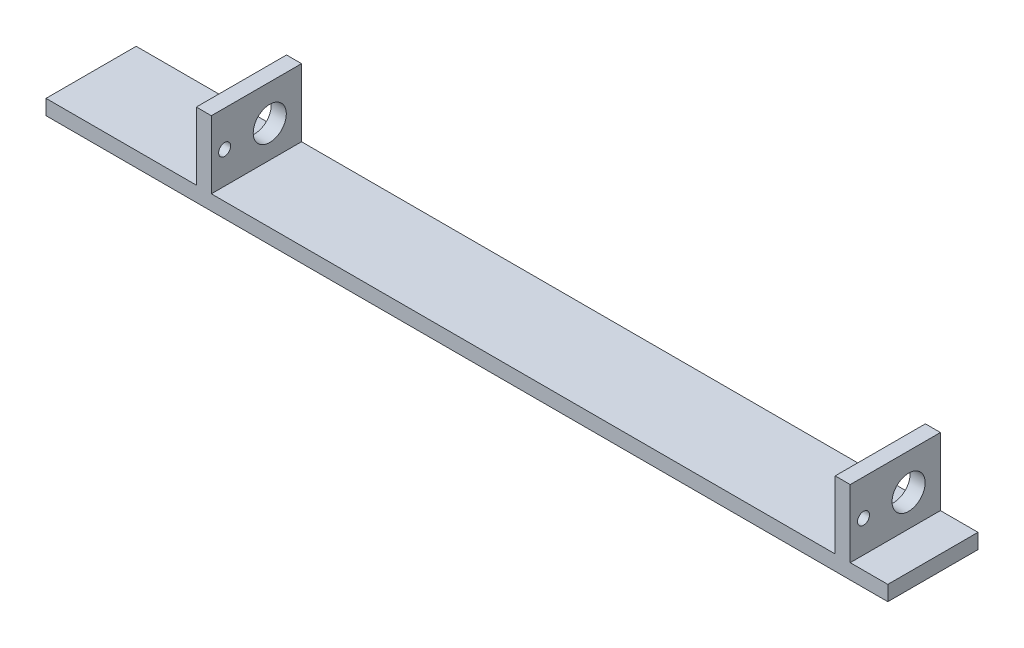
from build123d import *

# Parameters (mm, degrees)
SKETCH1_W           = 560
SKETCH1_H           = 60
BOSS_EXTRUDE1_DEPTH = 10
SKETCH2_W           = 10
SKETCH2_H           = 60
BOSS_EXTRUDE2_DEPTH = 45
SKETCH3_R           = 11
SKETCH3_R_2         = 4
CUT_EXTRUDE1_DEPTH  = 440
SKETCH4_R           = 5
BOSS_EXTRUDE3_DEPTH = 10


with BuildPart() as part:
    # Sketch1 → Boss-Extrude1 (new body)
    with BuildSketch(Plane(origin=(0, 0, 0), x_dir=(1, 0, 0), z_dir=(0, 1, 0))):
        Rectangle(SKETCH1_W, SKETCH1_H)
    extrude(amount=BOSS_EXTRUDE1_DEPTH)

    # Sketch2 → Boss-Extrude2 (add)
    with BuildSketch(Plane(origin=(0, 10, 0), x_dir=(1, 0, 0), z_dir=(0, 1, 0))):
        with Locations((-175, 0)):
            Rectangle(SKETCH2_W, SKETCH2_H)
        with Locations((250, 0)):
            Rectangle(SKETCH2_W, SKETCH2_H)
    extrude(amount=BOSS_EXTRUDE2_DEPTH)

    # Sketch3 → Cut-Extrude1 (cut)
    with BuildSketch(Plane.ZY.offset(180)):
        with Locations((-8.85, 31.15)):
            Circle(SKETCH3_R)
        with Locations((21.15, 31.15)):
            Circle(SKETCH3_R_2)
    extrude(amount=-CUT_EXTRUDE1_DEPTH, mode=Mode.SUBTRACT)

    # Sketch4 → Boss-Extrude3 (add)
    with BuildSketch(Plane.XZ):
        with Locations(Location((-270, 0, 0), (0, 0, 90))):
            Circle(SKETCH4_R)
        with Locations(Location((260, 0, 0), (0, 0, 90))):
            Circle(SKETCH4_R)
    extrude(amount=BOSS_EXTRUDE3_DEPTH)


solid = part.part
